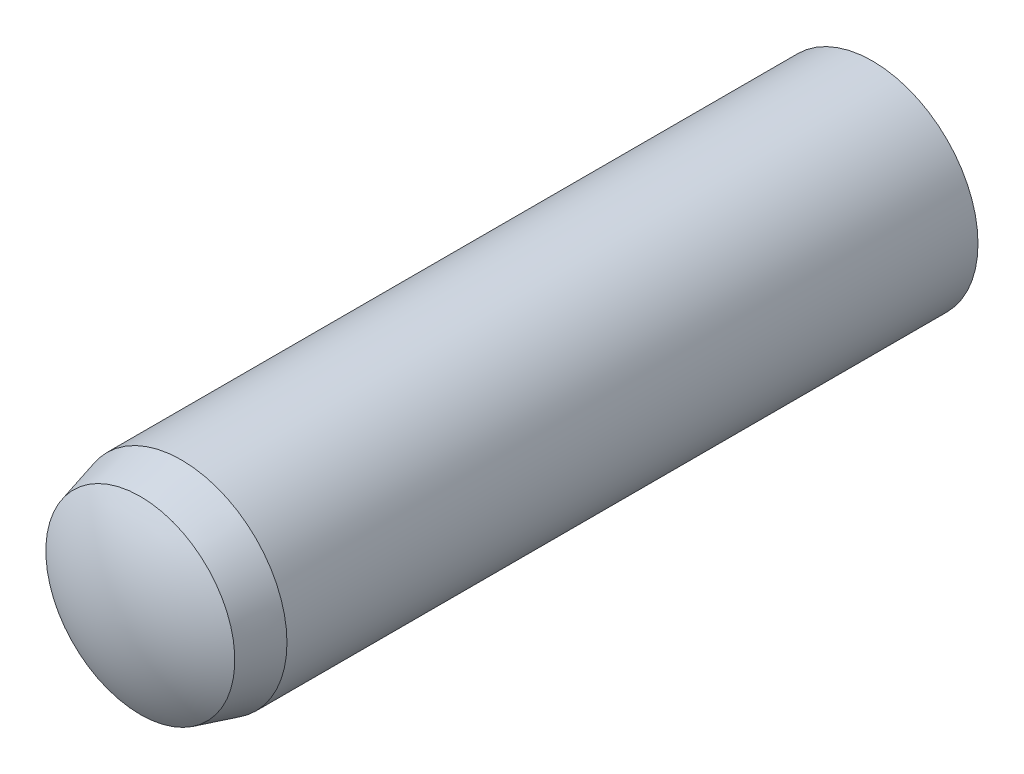
from build123d import *


with BuildPart() as part:
    # Sketch3 → Revolve1 (revolve)
    with BuildSketch(Plane(origin=(0, 0, 0), x_dir=(0, 0, -1), z_dir=(1, 0, 0))):
        with BuildLine():
            Line((-15, 0), (15, 0))
            ThreePointArc((15, 0), (14.693537673, 2.088061302), (13.8, 4))
            Line((13.8, 4), (-12.4, 4))
            Line((-12.4, 4), (-13.96, 3.58199926))
            ThreePointArc((-13.96, 3.58199926), (-14.734740106, 1.864961038), (-15, 0))
        make_face()
    revolve(axis=Axis((0, 0, 15), (0, 0, -1)))


solid = part.part
